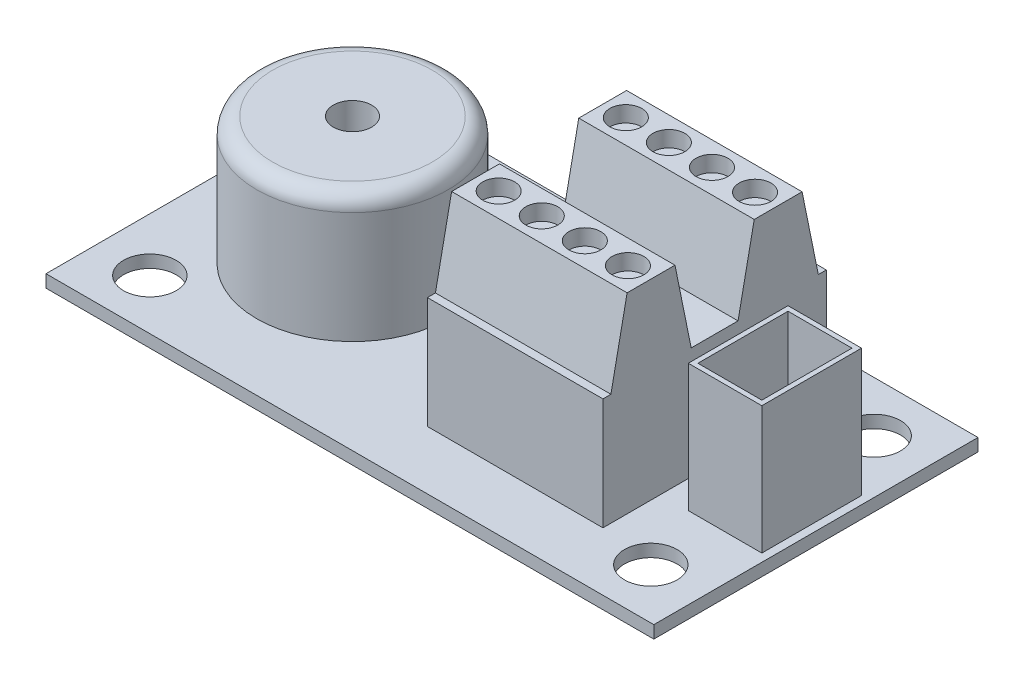
from build123d import *

# Parameters (mm, degrees)
SKETCH1_W           = 38.1
SKETCH1_H           = 20.32
BOSS_EXTRUDE1_DEPTH = 0.7874
SKETCH3_R           = 1.65
CUT_EXTRUDE2_DEPTH  = 10
SKETCH4_R           = 6
BOSS_EXTRUDE2_DEPTH = 8
FILLET1_R           = 1
SKETCH5_R           = 1.2
CUT_EXTRUDE3_DEPTH  = 2
SKETCH6_W           = 11
SKETCH6_H           = 14
BOSS_EXTRUDE3_DEPTH = 12
CUT_EXTRUDE4_DEPTH  = 12
SKETCH8_R           = 1
CUT_EXTRUDE5_DEPTH  = 1
SKETCH9_W           = 4.608332255
SKETCH9_H           = 6.248586108
SKETCH9_W_2         = 4.008332255
SKETCH9_H_2         = 5.648586108
BOSS_EXTRUDE4_DEPTH = 8


with BuildPart() as part:
    # Sketch1 → Boss-Extrude1 (new body)
    with BuildSketch(Plane(origin=(0, 0, 0), x_dir=(1, 0, 0), z_dir=(0, 1, 0))):
        Rectangle(SKETCH1_W, SKETCH1_H)
    extrude(amount=BOSS_EXTRUDE1_DEPTH)

    # Sketch3 → Cut-Extrude2 (cut)
    with BuildSketch(Plane.XZ):
        with Locations(Location((-15.7, 7, 0), (0, 0, 270))):
            Circle(SKETCH3_R)
        with Locations(Location((15.7, 7, 0), (0, 0, 270))):
            Circle(SKETCH3_R)
        with Locations(Location((15.7, -7, 0), (0, 0, 270))):
            Circle(SKETCH3_R)
        with Locations(Location((-15.7, -7, 0), (0, 0, 270))):
            Circle(SKETCH3_R)
    extrude(amount=-CUT_EXTRUDE2_DEPTH, mode=Mode.SUBTRACT)

    # Sketch4 → Boss-Extrude2 (add)
    with BuildSketch(Plane(origin=(0, 0.7874, 0), x_dir=(1, 0, 0), z_dir=(0, 1, 0))):
        with Locations(Location((-10, 0, 0), (0, 0, 270))):
            Circle(SKETCH4_R)
    extrude(amount=BOSS_EXTRUDE2_DEPTH)

    # Fillet1
    fillet1_edges = [part.edges().sort_by_distance(p)[0] for p in [
        (-10, 8.7874, -6),
    ]]
    fillet(fillet1_edges, radius=FILLET1_R)

    # Sketch5 → Cut-Extrude3 (cut)
    with BuildSketch(Plane(origin=(0, 8.7874, 0), x_dir=(1, 0, 0), z_dir=(0, 1, 0))):
        with Locations(Location((-10, 0, 0), (0, 0, 270))):
            Circle(SKETCH5_R)
    extrude(amount=-CUT_EXTRUDE3_DEPTH, mode=Mode.SUBTRACT)

    # Sketch6 → Boss-Extrude3 (add)
    with BuildSketch(Plane(origin=(0, 0.7874, 0), x_dir=(1, 0, 0), z_dir=(0, 1, 0))):
        with Locations((6.7, 0.5)):
            Rectangle(SKETCH6_W, SKETCH6_H)
    extrude(amount=BOSS_EXTRUDE3_DEPTH)

    # Sketch7 → Cut-Extrude4 (cut)
    with BuildSketch(Plane(origin=(12.2, 0, 0), x_dir=(0, 0, -1), z_dir=(1, 0, 0))):
        Polygon((-6, 7.7874), (-4.984156555, 12.7874), (-6.5, 12.7874), (-6.5, 7.7874), align=None)
        Polygon((-1.984156555, 12.7874), (-0.96831311, 7.7874), (1.96831311, 7.7874), (2.984156555, 12.7874), align=None)
        Polygon((5.984156555, 12.7874), (7, 7.7874), (7.5, 7.7874), (7.5, 12.7874), align=None)
    extrude(amount=-CUT_EXTRUDE4_DEPTH, mode=Mode.SUBTRACT)

    # Sketch8 → Cut-Extrude5 (cut)
    with BuildSketch(Plane(origin=(0, 12.7874, 0), x_dir=(1, 0, 0), z_dir=(0, 1, 0))):
        with Locations(Location((10.75, -3.484156555, 0), (0, 0, 270))):
            Circle(SKETCH8_R)
        with Locations(Location((8.05, -3.484156555, 0), (0, 0, 270))):
            Circle(SKETCH8_R)
        with Locations(Location((5.35, -3.484156555, 0), (0, 0, 270))):
            Circle(SKETCH8_R)
        with Locations(Location((2.65, -3.484156555, 0), (0, 0, 270))):
            Circle(SKETCH8_R)
        with Locations(Location((10.75, 4.484156555, 0), (0, 0, 270))):
            Circle(SKETCH8_R)
        with Locations(Location((8.05, 4.484156555, 0), (0, 0, 270))):
            Circle(SKETCH8_R)
        with Locations(Location((5.35, 4.484156555, 0), (0, 0, 270))):
            Circle(SKETCH8_R)
        with Locations(Location((2.65, 4.484156555, 0), (0, 0, 270))):
            Circle(SKETCH8_R)
    extrude(amount=-CUT_EXTRUDE5_DEPTH, mode=Mode.SUBTRACT)

    # Sketch9 → Boss-Extrude4 (add)
    with BuildSketch(Plane(origin=(0, 0.7874, 0), x_dir=(1, 0, 0), z_dir=(0, 1, 0))):
        with Locations((16.246323881, 0.234321979)):
            Rectangle(SKETCH9_W, SKETCH9_H)
        with Locations((16.246323881, 0.234321979)):
            Rectangle(SKETCH9_W_2, SKETCH9_H_2, mode=Mode.SUBTRACT)
    extrude(amount=BOSS_EXTRUDE4_DEPTH)


solid = part.part
